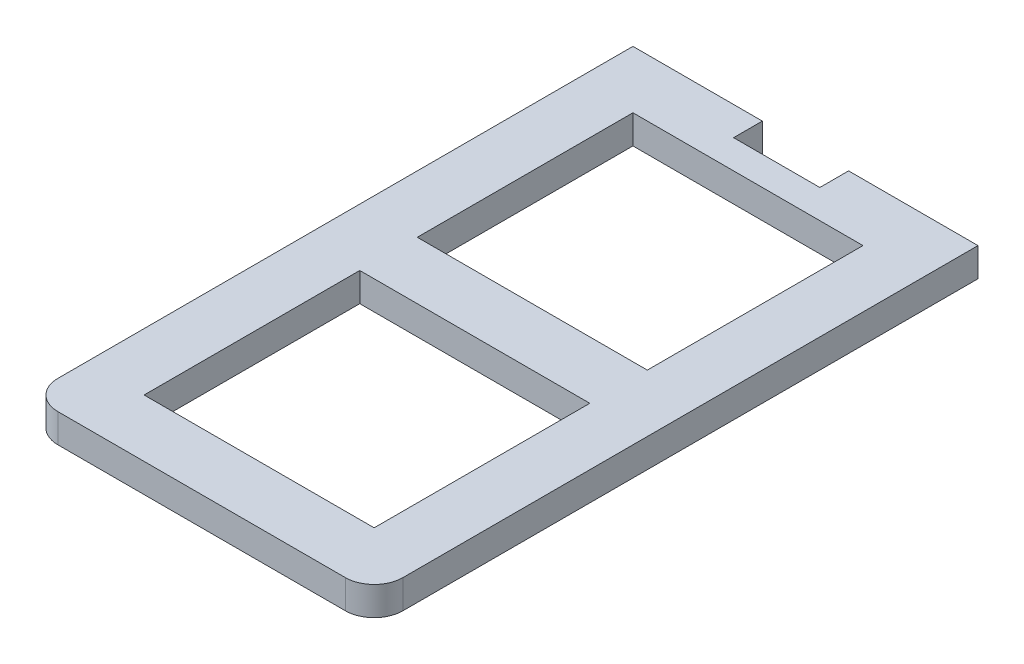
from build123d import *

# Parameters (mm, degrees)
SKETCH1_W           = 60
SKETCH1_H           = 5
BOSS_EXTRUDE1_DEPTH = 105
SKETCH2_W           = 40
SKETCH2_H           = 37.5
CUT_EXTRUDE1_DEPTH  = 105
FILLET1_R           = 5
SKETCH4_W           = 15
SKETCH4_H           = 10
CUT_EXTRUDE3_DEPTH  = 10


with BuildPart() as part:
    # Sketch1 → Boss-Extrude1 (new body)
    with BuildSketch(Plane.XY):
        Rectangle(SKETCH1_W, SKETCH1_H)
    extrude(amount=BOSS_EXTRUDE1_DEPTH)

    # Sketch2 → Cut-Extrude1 (cut)
    with BuildSketch(Plane.XZ.offset(2.5)):
        with Locations((0, 28.75)):
            Rectangle(SKETCH2_W, SKETCH2_H)
        with Locations((0, 76.25)):
            Rectangle(SKETCH2_W, SKETCH2_H)
    extrude(amount=-CUT_EXTRUDE1_DEPTH, mode=Mode.SUBTRACT)

    # Fillet1
    fillet1_edges = [part.edges().sort_by_distance(p)[0] for p in [
        (-30, 0, 105),
        (30, 0, 105),
    ]]
    fillet(fillet1_edges, radius=FILLET1_R)

    # Sketch4 → Cut-Extrude3 (cut)
    with BuildSketch(Plane.XZ.offset(2.5)):
        Rectangle(SKETCH4_W, SKETCH4_H)
    extrude(amount=-CUT_EXTRUDE3_DEPTH, mode=Mode.SUBTRACT)


solid = part.part
